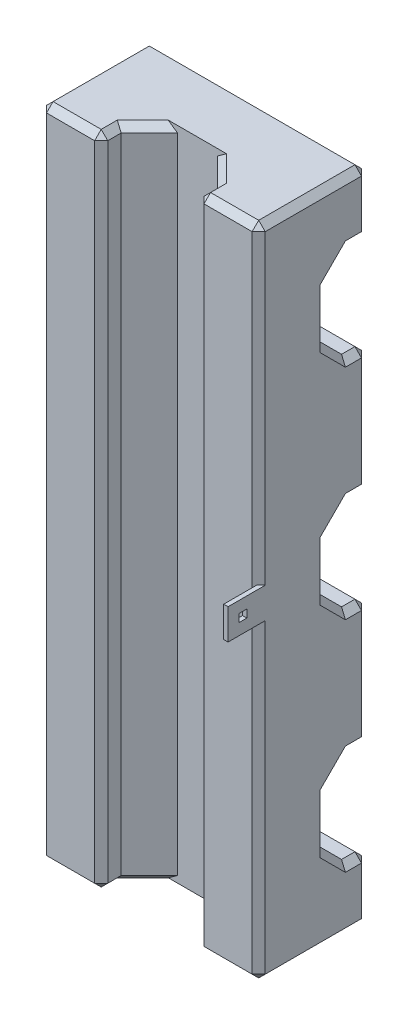
from build123d import *

# Parameters (mm, degrees)
SKETCH1_W                = 50
SKETCH1_H                = 150
BOSS_EXTRUDE1_DEPTH      = 25
CUT_EXTRUDE1_DEPTH       = 161.078105936
CUT_EXTRUDE2_DEPTH       = 161.078105936
LPATTERN1_COUNT          = 3
LPATTERN1_PITCH          = 50
CHAMFER1_SIZE            = 1.5
BOSS_EXTRUDE2_DEPTH      = 7
BOSS_EXTRUDE2_DEPTH_BACK = 10
SKETCH4_W                = 1
SKETCH4_H                = 7
SKETCH5_W                = 1.8
SKETCH5_H                = 1.8
CUT_EXTRUDE3_DEPTH       = 7


with BuildPart() as part:
    # Sketch1 → Boss-Extrude1 (new body)
    with BuildSketch(Plane.XY):
        with Locations((25, 75)):
            Rectangle(SKETCH1_W, SKETCH1_H)
    extrude(amount=BOSS_EXTRUDE1_DEPTH)

    # Sketch2 → Cut-Extrude1 (cut, through all)
    with BuildSketch(Plane.XZ):
        Polygon((29.556349186, 36), (20.443650814, 36), (14, 29.556349186), (14, 20.443650814), (20.443650814, 14), (29.556349186, 14), (36, 20.443650814), (36, 29.556349186), align=None)
    extrude(amount=-CUT_EXTRUDE1_DEPTH, mode=Mode.SUBTRACT)

    # Sketch3 → Cut-Extrude2 (cut, through all)
    with BuildSketch(Plane(origin=(50, 0, 0), x_dir=(0, 0, -1), z_dir=(1, 0, 0))):
        Polygon((-4.556349186, 36), (-11, 29.556349186), (-11, 20.443650814), (-4.556349186, 14), (4.556349186, 14), (11, 20.443650814), (11, 29.556349186), (4.556349186, 36), align=None)
    cut_extrude2 = extrude(amount=-CUT_EXTRUDE2_DEPTH, mode=Mode.SUBTRACT)

    # LPattern1: Cut-Extrude2 ×3
    with Locations(*[(0, i * LPATTERN1_PITCH, 0) for i in range(1, LPATTERN1_COUNT)]):
        add(cut_extrude2, mode=Mode.SUBTRACT)

    # Chamfer1
    chamfer1_edges = [part.edges().sort_by_distance(p)[0] for p in [
        (50, 75, 25),
        (50, 143, 0),
        (50, 136, 2.278174593),
        (0, 100, 0),
        (25, 136, 0),
        (25, 114, 0),
        (0, 136, 2.278174593),
        (0, 114, 2.278174593),
        (0, 117.221825407, 7.778174593),
        (0, 132.778174593, 7.778174593),
        (50, 132.778174593, 7.778174593),
        (50, 117.221825407, 7.778174593),
        (50, 114, 2.278174593),
        (43, 150, 25),
        (43, 0, 25),
        (7, 150, 25),
        (14, 75, 25),
        (36, 75, 25),
        (36, 150, 22.721825407),
        (14, 150, 22.721825407),
        (36, 0, 22.721825407),
        (14, 0, 22.721825407),
        (17.221825407, 0, 17.221825407),
        (32.778174593, 0, 17.221825407),
        (32.778174593, 150, 17.221825407),
        (17.221825407, 150, 17.221825407),
        (0, 75, 25),
        (25, 150, 0),
        (50, 7, 0),
        (25, 0, 0),
        (0, 7, 0),
        (50, 50, 0),
        (25, 14, 0),
        (25, 36, 0),
        (0, 143, 0),
        (0, 36, 2.278174593),
        (0, 14, 2.278174593),
        (0, 17.221825407, 7.778174593),
        (0, 32.778174593, 7.778174593),
        (50, 36, 2.278174593),
        (50, 32.778174593, 7.778174593),
        (50, 17.221825407, 7.778174593),
        (50, 14, 2.278174593),
        (7, 0, 25),
        (0, 150, 12.5),
        (50, 150, 12.5),
        (50, 0, 12.5),
        (0, 0, 12.5),
        (50, 100, 0),
        (50, 86, 2.278174593),
        (0, 50, 0),
        (25, 86, 0),
        (25, 64, 0),
        (0, 86, 2.278174593),
        (0, 64, 2.278174593),
        (0, 67.221825407, 7.778174593),
        (0, 82.778174593, 7.778174593),
        (50, 82.778174593, 7.778174593),
        (50, 67.221825407, 7.778174593),
        (50, 64, 2.278174593),
    ]]
    chamfer(chamfer1_edges, length=CHAMFER1_SIZE)

    # Sketch4 → Boss-Extrude2 (add, two sides: drawn at the far end of the back side and taken through both)
    with BuildSketch(Plane.XY.offset(25).offset(-BOSS_EXTRUDE2_DEPTH_BACK)):
        with Locations((49.5, 75)):
            Rectangle(SKETCH4_W, SKETCH4_H)
    extrude(amount=BOSS_EXTRUDE2_DEPTH + BOSS_EXTRUDE2_DEPTH_BACK)

    # Sketch5 → Cut-Extrude3 (cut)
    with BuildSketch(Plane(origin=(50, 0, 0), x_dir=(0, 0, -1), z_dir=(1, 0, 0))):
        with Locations((-28.6, 75)):
            Rectangle(SKETCH5_W, SKETCH5_H)
    extrude(amount=-CUT_EXTRUDE3_DEPTH, mode=Mode.SUBTRACT)


solid = part.part
